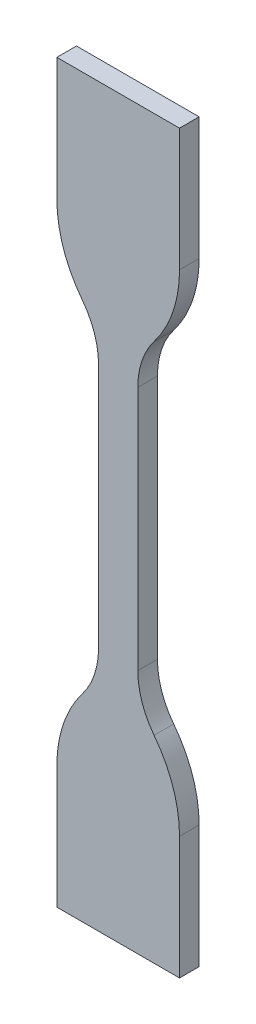
from build123d import *

# Parameters (mm, degrees)
STREKKPR_VE_DEPTH = 1
FILLET1_R         = 12.5


with BuildPart() as part:
    # Sketch1 → Strekkprøve (new, symmetric)
    with BuildSketch(Plane.XY):
        with BuildLine():
            Line((2, -12.5), (2, 12.5))
            ThreePointArc((2, 12.5), (3.1443454, 16.623105626), (6.25, 19.566647013))
            Line((6.25, 19.566647013), (6.25, 37.5))
            Line((6.25, 37.5), (-6.25, 37.5))
            Line((-6.25, 37.5), (-6.25, 19.566647013))
            ThreePointArc((-6.25, 19.566647013), (-3.1443454, 16.623105626), (-2, 12.5))
            Line((-2, 12.5), (-2, -12.5))
            ThreePointArc((-2, -12.5), (-3.1443454, -16.623105626), (-6.25, -19.566647013))
            Line((-6.25, -19.566647013), (-6.25, -37.5))
            Line((-6.25, -37.5), (6.25, -37.5))
            Line((6.25, -37.5), (6.25, -19.566647013))
            ThreePointArc((6.25, -19.566647013), (3.1443454, -16.623105626), (2, -12.5))
        make_face()
    extrude(amount=STREKKPR_VE_DEPTH, both=True)

    # Fillet1
    fillet1_edges = [part.edges().sort_by_distance(p)[0] for p in [
        (6.25, -19.566647013, 0),
        (-6.25, -19.566647013, 0),
        (-6.25, 19.566647013, 0),
        (6.25, 19.566647013, 0),
    ]]
    fillet(fillet1_edges, radius=FILLET1_R)


solid = part.part
